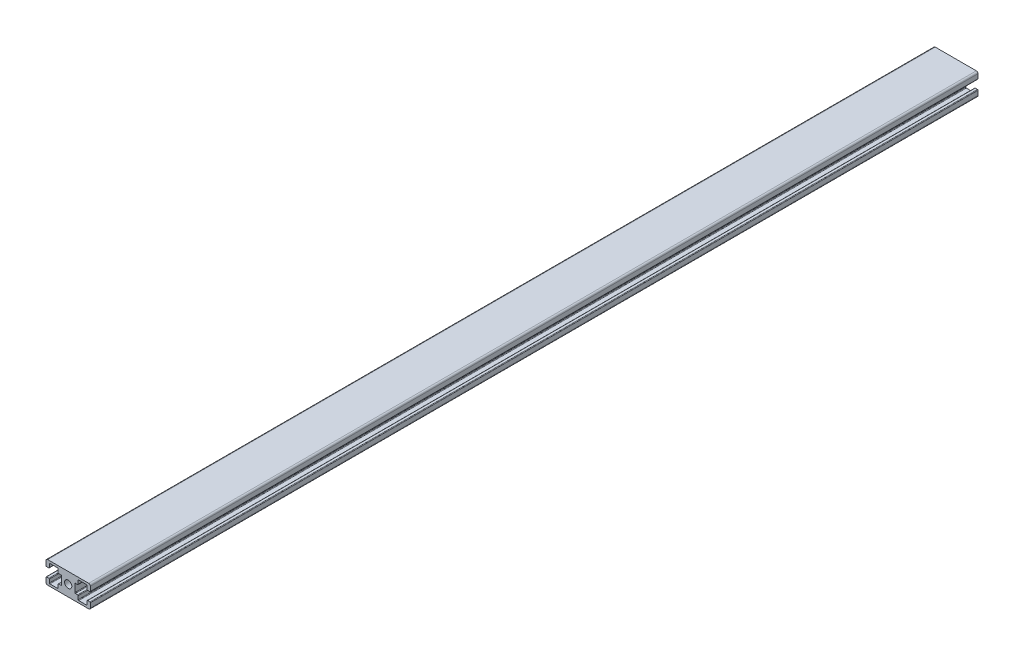
from build123d import *

# Parameters (mm, degrees)
SKETCH1_R           = 3.25
BOSS_EXTRUDE1_DEPTH = 400


with BuildPart() as part:
    # Sketch1 → Boss-Extrude1 (new, symmetric)
    with BuildSketch(Plane.XY):
        with BuildLine():
            Line((1.5, 0), (38.5, 0))
            ThreePointArc((38.5, 0), (39.560660172, 0.439339828), (40, 1.5))
            Line((40, 1.5), (40, 5.5))
            ThreePointArc((40, 5.5), (39.853553391, 5.853553391), (39.5, 6))
            Line((39.5, 6), (37.5, 6))
            ThreePointArc((37.5, 6), (37.146446609, 5.853553391), (37, 5.5))
            Line((37, 5.5), (37, 2.5))
            ThreePointArc((37, 2.5), (36.853553391, 2.146446609), (36.5, 2))
            Line((36.5, 2), (29.5, 2))
            ThreePointArc((29.5, 2), (29.146446609, 2.146446609), (29, 2.5))
            Line((29, 2.5), (29, 5.5))
            ThreePointArc((29, 5.5), (28.853553391, 5.853553391), (28.5, 6))
            Line((28.5, 6), (26.5, 6))
            ThreePointArc((26.5, 6), (26.146446609, 6.146446609), (26, 6.5))
            Line((26, 6.5), (26, 13.5))
            ThreePointArc((26, 13.5), (26.146446609, 13.853553391), (26.5, 14))
            Line((26.5, 14), (28.5, 14))
            ThreePointArc((28.5, 14), (28.853553391, 14.146446609), (29, 14.5))
            Line((29, 14.5), (29, 17.5))
            ThreePointArc((29, 17.5), (29.146446609, 17.853553391), (29.5, 18))
            Line((29.5, 18), (36.5, 18))
            ThreePointArc((36.5, 18), (36.853553391, 17.853553391), (37, 17.5))
            Line((37, 17.5), (37, 14.5))
            ThreePointArc((37, 14.5), (37.146446609, 14.146446609), (37.5, 14))
            Line((37.5, 14), (39.5, 14))
            ThreePointArc((39.5, 14), (39.853553391, 14.146446609), (40, 14.5))
            Line((40, 14.5), (40, 18.5))
            ThreePointArc((40, 18.5), (39.560660172, 19.560660172), (38.5, 20))
            Line((38.5, 20), (1.5, 20))
            ThreePointArc((1.5, 20), (0.439339828, 19.560660172), (0, 18.5))
            Line((0, 18.5), (0, 14.5))
            ThreePointArc((0, 14.5), (0.146446609, 14.146446609), (0.5, 14))
            Line((0.5, 14), (2.5, 14))
            ThreePointArc((2.5, 14), (2.853553391, 14.146446609), (3, 14.5))
            Line((3, 14.5), (3, 17.5))
            ThreePointArc((3, 17.5), (3.146446609, 17.853553391), (3.5, 18))
            Line((3.5, 18), (10.5, 18))
            ThreePointArc((10.5, 18), (10.853553391, 17.853553391), (11, 17.5))
            Line((11, 17.5), (11, 14.5))
            ThreePointArc((11, 14.5), (11.146446609, 14.146446609), (11.5, 14))
            Line((11.5, 14), (13.5, 14))
            ThreePointArc((13.5, 14), (13.853553391, 13.853553391), (14, 13.5))
            Line((14, 13.5), (14, 6.5))
            ThreePointArc((14, 6.5), (13.853553391, 6.146446609), (13.5, 6))
            Line((13.5, 6), (11.5, 6))
            ThreePointArc((11.5, 6), (11.146446609, 5.853553391), (11, 5.5))
            Line((11, 5.5), (11, 2.5))
            ThreePointArc((11, 2.5), (10.853553391, 2.146446609), (10.5, 2))
            Line((10.5, 2), (3.5, 2))
            ThreePointArc((3.5, 2), (3.146446609, 2.146446609), (3, 2.5))
            Line((3, 2.5), (3, 5.5))
            ThreePointArc((3, 5.5), (2.853553391, 5.853553391), (2.5, 6))
            Line((2.5, 6), (0.5, 6))
            ThreePointArc((0.5, 6), (0.146446609, 5.853553391), (0, 5.5))
            Line((0, 5.5), (0, 1.5))
            ThreePointArc((0, 1.5), (0.439339828, 0.439339828), (1.5, 0))
        make_face()
        with Locations((20, 10)):
            Circle(SKETCH1_R, mode=Mode.SUBTRACT)
    extrude(amount=BOSS_EXTRUDE1_DEPTH, both=True)


solid = part.part
